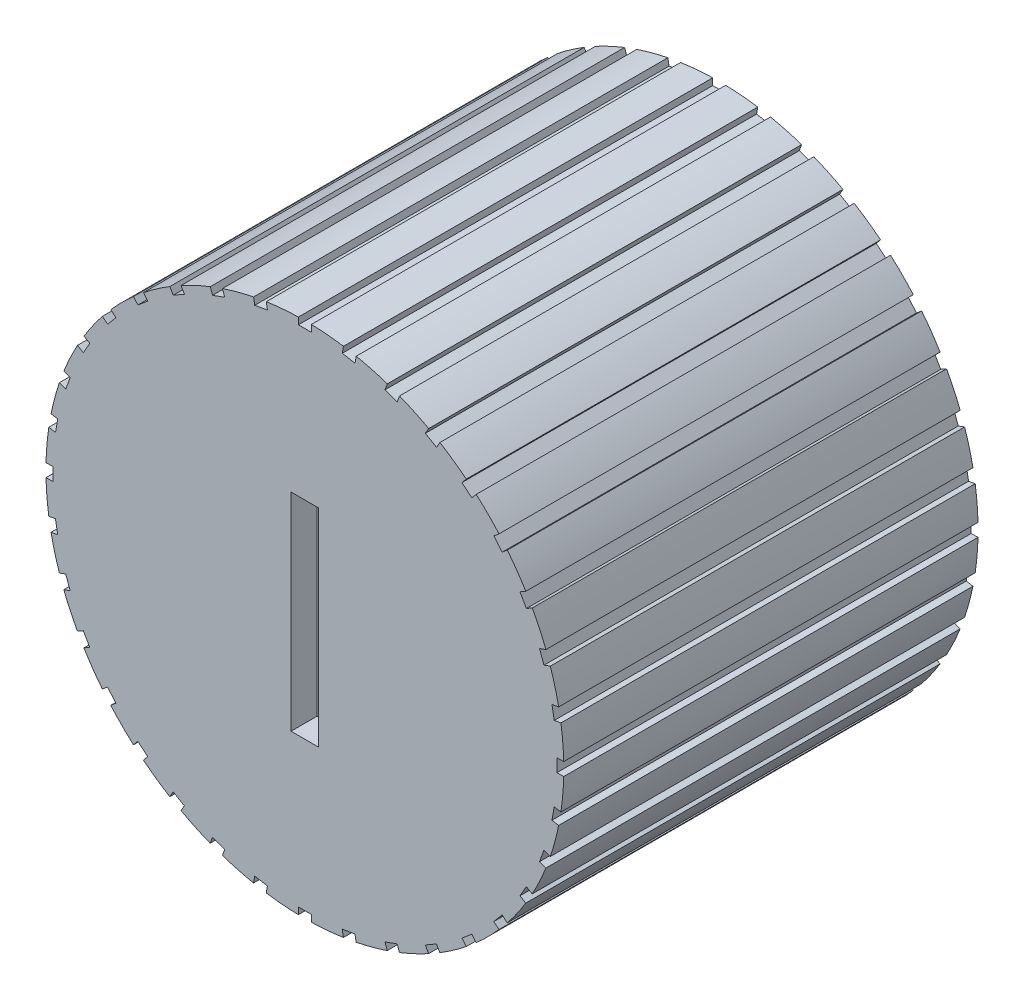
from build123d import *

# Parameters (mm, degrees)
SKETCH1_W                    = 10.000000149
SKETCH1_H                    = 16
CUT_EXTRUDE1_START           = -16
CUT_EXTRUDE1_DEPTH           = 16
CUT_EXTRUDE2_START           = -16
CUT_EXTRUDE2_DEPTH           = 16
CUT_EXTRUDE3_START           = -16
CUT_EXTRUDE3_DEPTH           = 16
CUT_EXTRUDE4_START           = -16
CUT_EXTRUDE4_DEPTH           = 16
CUT_EXTRUDE5_START           = -16
CUT_EXTRUDE5_DEPTH           = 16
CUT_EXTRUDE6_START           = -16
CUT_EXTRUDE6_DEPTH           = 16
CUT_EXTRUDE7_START           = -16
CUT_EXTRUDE7_DEPTH           = 16
CUT_EXTRUDE8_START           = -16
CUT_EXTRUDE8_DEPTH           = 16
CUT_EXTRUDE9_START           = -16
CUT_EXTRUDE9_DEPTH           = 16
CUT_EXTRUDE10_START          = -16
CUT_EXTRUDE10_DEPTH          = 16
CUT_EXTRUDE11_START          = -16
CUT_EXTRUDE11_DEPTH          = 16
CUT_EXTRUDE12_START          = -16
CUT_EXTRUDE12_DEPTH          = 16
CUT_EXTRUDE13_START          = -16
CUT_EXTRUDE13_DEPTH          = 16
CUT_EXTRUDE14_START          = -16
CUT_EXTRUDE14_DEPTH          = 16
CUT_EXTRUDE15_START          = -16
CUT_EXTRUDE15_DEPTH          = 16
CUT_EXTRUDE16_START          = -16
CUT_EXTRUDE16_DEPTH          = 16
CUT_EXTRUDE17_START          = -16
CUT_EXTRUDE17_DEPTH          = 16
CUT_EXTRUDE18_START          = -16
CUT_EXTRUDE18_DEPTH          = 16
CUT_EXTRUDE19_START          = -16
CUT_EXTRUDE19_DEPTH          = 16
CUT_EXTRUDE20_START          = -16
CUT_EXTRUDE20_DEPTH          = 16
CUT_EXTRUDE21_START          = -16
CUT_EXTRUDE21_DEPTH          = 16
CUT_EXTRUDE22_START          = -16
CUT_EXTRUDE22_DEPTH          = 16
CUT_EXTRUDE23_START          = -16
CUT_EXTRUDE23_DEPTH          = 16
CUT_EXTRUDE24_START          = -16
CUT_EXTRUDE24_DEPTH          = 16
CUT_EXTRUDE25_START          = -16
CUT_EXTRUDE25_DEPTH          = 16
CUT_EXTRUDE26_START          = -16
CUT_EXTRUDE26_DEPTH          = 16
CUT_EXTRUDE27_START          = -16
CUT_EXTRUDE27_DEPTH          = 16
CUT_EXTRUDE28_START          = -16
CUT_EXTRUDE28_DEPTH          = 16
CUT_EXTRUDE29_START          = -16
CUT_EXTRUDE29_DEPTH          = 16
CUT_EXTRUDE30_START          = -16
CUT_EXTRUDE30_DEPTH          = 16
CUT_EXTRUDE31_START          = -16
CUT_EXTRUDE31_DEPTH          = 16
CUT_EXTRUDE32_START          = -16
CUT_EXTRUDE32_DEPTH          = 16
CUT_EXTRUDE33_START          = -16
CUT_EXTRUDE33_DEPTH          = 16
CUT_EXTRUDE34_START          = -16
CUT_EXTRUDE34_DEPTH          = 16
CUT_EXTRUDE35_START          = -16
CUT_EXTRUDE35_DEPTH          = 16
CUT_EXTRUDE36_START          = -16
CUT_EXTRUDE36_DEPTH          = 16
CUT_EXTRUDE37_DEPTH          = 1
F_6_0_6_DIAMETER_HOLE1_D     = 6
F_6_0_6_DIAMETER_HOLE1_DEPTH = 14


with BuildPart() as part:
    # Sketch1 → Revolve1 (revolve)
    with BuildSketch(Plane(origin=(0, 0, 0), x_dir=(1, 0, 0), z_dir=(0, 1, 0))):
        with Locations((5.000000074, -8)):
            Rectangle(SKETCH1_W, SKETCH1_H)
    revolve(axis=Axis((0, 0, 0), (0, 0, 1)))

    # Sketch2 → Cut-Extrude1 (cut)
    with BuildSketch(Plane.XY.offset(16).offset(CUT_EXTRUDE1_START)):
        with BuildLine():
            Line((-0.248423386, 9.996913964), (-0.248423386, 9.735553523))
            Line((-0.248423386, 9.735553523), (0.251275635, 9.735553523))
            Line((0.251275635, 9.735553523), (0.251275635, 9.996842678))
            ThreePointArc((0.251275635, 9.996842678), (0.00142657, 10.000000047), (-0.248423386, 9.996913964))
        make_face()
    extrude(amount=CUT_EXTRUDE1_DEPTH, mode=Mode.SUBTRACT)

    # Sketch3 → Cut-Extrude2 (cut)
    with BuildSketch(Plane.XY.offset(16).offset(CUT_EXTRUDE2_START)):
        with BuildLine():
            Line((1.491296615, 9.888176646), (1.445911851, 9.630786858))
            Line((1.445911851, 9.630786858), (1.938019322, 9.544015033))
            Line((1.938019322, 9.544015033), (1.983391707, 9.801334619))
            ThreePointArc((1.983391707, 9.801334619), (1.737886682, 9.847829855), (1.491296615, 9.888176646))
        make_face()
    extrude(amount=CUT_EXTRUDE2_DEPTH, mode=Mode.SUBTRACT)

    # Sketch4 → Cut-Extrude3 (cut)
    with BuildSketch(Plane.XY.offset(16).offset(CUT_EXTRUDE3_START)):
        with BuildLine():
            Line((3.185704324, 9.478992085), (3.096313789, 9.233393607))
            Line((3.096313789, 9.233393607), (3.565877272, 9.062486476))
            Line((3.565877272, 9.062486476), (3.655243426, 9.308017967))
            ThreePointArc((3.655243426, 9.308017967), (3.421541987, 9.396438337), (3.185704324, 9.478992085))
        make_face()
    extrude(amount=CUT_EXTRUDE3_DEPTH, mode=Mode.SUBTRACT)

    # Sketch5 → Cut-Extrude4 (cut)
    with BuildSketch(Plane.XY.offset(16).offset(CUT_EXTRUDE4_START)):
        with BuildLine():
            Line((4.783316019, 8.781793145), (4.652635798, 8.555448364))
            Line((4.652635798, 8.555448364), (5.085387845, 8.305598853))
            Line((5.085387845, 8.305598853), (5.216032423, 8.531881899))
            ThreePointArc((5.216032423, 8.531881899), (5.001235469, 8.659540794), (4.783316019, 8.781793145))
        make_face()
    extrude(amount=CUT_EXTRUDE4_DEPTH, mode=Mode.SUBTRACT)

    # Sketch6 → Cut-Extrude5 (cut)
    with BuildSketch(Plane.XY.offset(16).offset(CUT_EXTRUDE5_START)):
        with BuildLine():
            Line((6.235589077, 7.817763865), (6.067589824, 7.617550152))
            Line((6.067589824, 7.617550152), (6.450381482, 7.296349812))
            Line((6.450381482, 7.296349812), (6.618334914, 7.496508918))
            ThreePointArc((6.618334914, 7.496508918), (6.428968943, 7.659527486), (6.235589077, 7.817763865))
        make_face()
    extrude(amount=CUT_EXTRUDE5_DEPTH, mode=Mode.SUBTRACT)

    # Sketch7 → Cut-Extrude6 (cut)
    with BuildSketch(Plane.XY.offset(16).offset(CUT_EXTRUDE6_START)):
        with BuildLine():
            Line((7.498396916, 6.616195786), (7.298183202, 6.448196533))
            Line((7.298183202, 6.448196533), (7.619383542, 6.065404874))
            Line((7.619383542, 6.065404874), (7.819542647, 6.233358306))
            ThreePointArc((7.819542647, 6.233358306), (7.661361449, 6.426783311), (7.498396916, 6.616195786))
        make_face()
    extrude(amount=CUT_EXTRUDE6_DEPTH, mode=Mode.SUBTRACT)

    # Sketch8 → Cut-Extrude7 (cut)
    with BuildSketch(Plane.XY.offset(16).offset(CUT_EXTRUDE7_START)):
        with BuildLine():
            Line((8.533369759, 5.213597945), (8.307024978, 5.082917725))
            Line((8.307024978, 5.082917725), (8.556874488, 4.650165678))
            Line((8.556874488, 4.650165678), (8.783157535, 4.780810256))
            ThreePointArc((8.783157535, 4.780810256), (8.660967364, 4.998764578), (8.533369759, 5.213597945))
        make_face()
    extrude(amount=CUT_EXTRUDE7_DEPTH, mode=Mode.SUBTRACT)

    # Sketch9 → Cut-Extrude8 (cut)
    with BuildSketch(Plane.XY.offset(16).offset(CUT_EXTRUDE8_START)):
        with BuildLine():
            Line((9.30906048, 3.65258757), (9.063462003, 3.563197034))
            Line((9.063462003, 3.563197034), (9.234369134, 3.093633551))
            Line((9.234369134, 3.093633551), (9.479900625, 3.182999705))
            ThreePointArc((9.479900625, 3.182999705), (9.397414168, 3.418860912), (9.30906048, 3.65258757))
        make_face()
    extrude(amount=CUT_EXTRUDE8_DEPTH, mode=Mode.SUBTRACT)

    # Sketch10 → Cut-Extrude9 (cut)
    with BuildSketch(Plane.XY.offset(16).offset(CUT_EXTRUDE9_START)):
        with BuildLine():
            Line((9.80190011, 1.980595169), (9.544510321, 1.935210405))
            Line((9.544510321, 1.935210405), (9.631282146, 1.443102934))
            Line((9.631282146, 1.443102934), (9.888601731, 1.48847532))
            ThreePointArc((9.888601731, 1.48847532), (9.848325298, 1.735076888), (9.80190011, 1.980595169))
        make_face()
    extrude(amount=CUT_EXTRUDE9_DEPTH, mode=Mode.SUBTRACT)

    # Sketch11 → Cut-Extrude10 (cut)
    with BuildSketch(Plane.XY.offset(16).offset(CUT_EXTRUDE10_START)):
        with BuildLine():
            Line((9.996913964, 0.248423386), (9.735553523, 0.248423386))
            Line((9.735553523, 0.248423386), (9.735553523, -0.251275635))
            Line((9.735553523, -0.251275635), (9.996842678, -0.251275635))
            ThreePointArc((9.996842678, -0.251275635), (10.000000047, -0.00142657), (9.996913964, 0.248423386))
        make_face()
    extrude(amount=CUT_EXTRUDE10_DEPTH, mode=Mode.SUBTRACT)

    # Sketch12 → Cut-Extrude11 (cut)
    with BuildSketch(Plane.XY.offset(16).offset(CUT_EXTRUDE11_START)):
        with BuildLine():
            Line((9.888176646, -1.491296615), (9.630786858, -1.445911851))
            Line((9.630786858, -1.445911851), (9.544015033, -1.938019322))
            Line((9.544015033, -1.938019322), (9.801334619, -1.983391707))
            ThreePointArc((9.801334619, -1.983391707), (9.847829855, -1.737886682), (9.888176646, -1.491296615))
        make_face()
    extrude(amount=CUT_EXTRUDE11_DEPTH, mode=Mode.SUBTRACT)

    # Sketch13 → Cut-Extrude12 (cut)
    with BuildSketch(Plane.XY.offset(16).offset(CUT_EXTRUDE12_START)):
        with BuildLine():
            Line((9.478992085, -3.185704324), (9.233393607, -3.096313789))
            Line((9.233393607, -3.096313789), (9.062486476, -3.565877272))
            Line((9.062486476, -3.565877272), (9.308017967, -3.655243426))
            ThreePointArc((9.308017967, -3.655243426), (9.396438337, -3.421541987), (9.478992085, -3.185704324))
        make_face()
    extrude(amount=CUT_EXTRUDE12_DEPTH, mode=Mode.SUBTRACT)

    # Sketch14 → Cut-Extrude13 (cut)
    with BuildSketch(Plane.XY.offset(16).offset(CUT_EXTRUDE13_START)):
        with BuildLine():
            Line((8.781793145, -4.783316019), (8.555448364, -4.652635798))
            Line((8.555448364, -4.652635798), (8.305598853, -5.085387845))
            Line((8.305598853, -5.085387845), (8.531881899, -5.216032423))
            ThreePointArc((8.531881899, -5.216032423), (8.659540794, -5.001235469), (8.781793145, -4.783316019))
        make_face()
    extrude(amount=CUT_EXTRUDE13_DEPTH, mode=Mode.SUBTRACT)

    # Sketch15 → Cut-Extrude14 (cut)
    with BuildSketch(Plane.XY.offset(16).offset(CUT_EXTRUDE14_START)):
        with BuildLine():
            Line((7.817763865, -6.235589077), (7.617550152, -6.067589824))
            Line((7.617550152, -6.067589824), (7.296349812, -6.450381482))
            Line((7.296349812, -6.450381482), (7.496508918, -6.618334914))
            ThreePointArc((7.496508918, -6.618334914), (7.659527486, -6.428968943), (7.817763865, -6.235589077))
        make_face()
    extrude(amount=CUT_EXTRUDE14_DEPTH, mode=Mode.SUBTRACT)

    # Sketch16 → Cut-Extrude15 (cut)
    with BuildSketch(Plane.XY.offset(16).offset(CUT_EXTRUDE15_START)):
        with BuildLine():
            Line((6.616195786, -7.498396916), (6.448196533, -7.298183202))
            Line((6.448196533, -7.298183202), (6.065404874, -7.619383542))
            Line((6.065404874, -7.619383542), (6.233358306, -7.819542647))
            ThreePointArc((6.233358306, -7.819542647), (6.426783311, -7.661361449), (6.616195786, -7.498396916))
        make_face()
    extrude(amount=CUT_EXTRUDE15_DEPTH, mode=Mode.SUBTRACT)

    # Sketch17 → Cut-Extrude16 (cut)
    with BuildSketch(Plane.XY.offset(16).offset(CUT_EXTRUDE16_START)):
        with BuildLine():
            Line((5.213597945, -8.533369759), (5.082917725, -8.307024978))
            Line((5.082917725, -8.307024978), (4.650165678, -8.556874488))
            Line((4.650165678, -8.556874488), (4.780810256, -8.783157535))
            ThreePointArc((4.780810256, -8.783157535), (4.998764578, -8.660967364), (5.213597945, -8.533369759))
        make_face()
    extrude(amount=CUT_EXTRUDE16_DEPTH, mode=Mode.SUBTRACT)

    # Sketch18 → Cut-Extrude17 (cut)
    with BuildSketch(Plane.XY.offset(16).offset(CUT_EXTRUDE17_START)):
        with BuildLine():
            Line((3.65258757, -9.30906048), (3.563197034, -9.063462003))
            Line((3.563197034, -9.063462003), (3.093633551, -9.234369134))
            Line((3.093633551, -9.234369134), (3.182999705, -9.479900625))
            ThreePointArc((3.182999705, -9.479900625), (3.418860912, -9.397414168), (3.65258757, -9.30906048))
        make_face()
    extrude(amount=CUT_EXTRUDE17_DEPTH, mode=Mode.SUBTRACT)

    # Sketch19 → Cut-Extrude18 (cut)
    with BuildSketch(Plane.XY.offset(16).offset(CUT_EXTRUDE18_START)):
        with BuildLine():
            Line((1.980595169, -9.80190011), (1.935210405, -9.544510321))
            Line((1.935210405, -9.544510321), (1.443102934, -9.631282146))
            Line((1.443102934, -9.631282146), (1.48847532, -9.888601731))
            ThreePointArc((1.48847532, -9.888601731), (1.735076888, -9.848325298), (1.980595169, -9.80190011))
        make_face()
    extrude(amount=CUT_EXTRUDE18_DEPTH, mode=Mode.SUBTRACT)

    # Sketch20 → Cut-Extrude19 (cut)
    with BuildSketch(Plane.XY.offset(16).offset(CUT_EXTRUDE19_START)):
        with BuildLine():
            Line((0.248423386, -9.996913964), (0.248423386, -9.735553523))
            Line((0.248423386, -9.735553523), (-0.251275635, -9.735553523))
            Line((-0.251275635, -9.735553523), (-0.251275635, -9.996842678))
            ThreePointArc((-0.251275635, -9.996842678), (-0.00142657, -10.000000047), (0.248423386, -9.996913964))
        make_face()
    extrude(amount=CUT_EXTRUDE19_DEPTH, mode=Mode.SUBTRACT)

    # Sketch21 → Cut-Extrude20 (cut)
    with BuildSketch(Plane.XY.offset(16).offset(CUT_EXTRUDE20_START)):
        with BuildLine():
            Line((-1.491296615, -9.888176646), (-1.445911851, -9.630786858))
            Line((-1.445911851, -9.630786858), (-1.938019322, -9.544015033))
            Line((-1.938019322, -9.544015033), (-1.983391707, -9.801334619))
            ThreePointArc((-1.983391707, -9.801334619), (-1.737886682, -9.847829855), (-1.491296615, -9.888176646))
        make_face()
    extrude(amount=CUT_EXTRUDE20_DEPTH, mode=Mode.SUBTRACT)

    # Sketch22 → Cut-Extrude21 (cut)
    with BuildSketch(Plane.XY.offset(16).offset(CUT_EXTRUDE21_START)):
        with BuildLine():
            Line((-3.185704324, -9.478992085), (-3.096313789, -9.233393607))
            Line((-3.096313789, -9.233393607), (-3.565877272, -9.062486476))
            Line((-3.565877272, -9.062486476), (-3.655243426, -9.308017967))
            ThreePointArc((-3.655243426, -9.308017967), (-3.421541987, -9.396438337), (-3.185704324, -9.478992085))
        make_face()
    extrude(amount=CUT_EXTRUDE21_DEPTH, mode=Mode.SUBTRACT)

    # Sketch23 → Cut-Extrude22 (cut)
    with BuildSketch(Plane.XY.offset(16).offset(CUT_EXTRUDE22_START)):
        with BuildLine():
            Line((-4.783316019, -8.781793145), (-4.652635798, -8.555448364))
            Line((-4.652635798, -8.555448364), (-5.085387845, -8.305598853))
            Line((-5.085387845, -8.305598853), (-5.216032423, -8.531881899))
            ThreePointArc((-5.216032423, -8.531881899), (-5.001235469, -8.659540794), (-4.783316019, -8.781793145))
        make_face()
    extrude(amount=CUT_EXTRUDE22_DEPTH, mode=Mode.SUBTRACT)

    # Sketch24 → Cut-Extrude23 (cut)
    with BuildSketch(Plane.XY.offset(16).offset(CUT_EXTRUDE23_START)):
        with BuildLine():
            Line((-6.235589077, -7.817763865), (-6.067589824, -7.617550152))
            Line((-6.067589824, -7.617550152), (-6.450381482, -7.296349812))
            Line((-6.450381482, -7.296349812), (-6.618334914, -7.496508918))
            ThreePointArc((-6.618334914, -7.496508918), (-6.428968943, -7.659527486), (-6.235589077, -7.817763865))
        make_face()
    extrude(amount=CUT_EXTRUDE23_DEPTH, mode=Mode.SUBTRACT)

    # Sketch25 → Cut-Extrude24 (cut)
    with BuildSketch(Plane.XY.offset(16).offset(CUT_EXTRUDE24_START)):
        with BuildLine():
            Line((-7.498396916, -6.616195786), (-7.298183202, -6.448196533))
            Line((-7.298183202, -6.448196533), (-7.619383542, -6.065404874))
            Line((-7.619383542, -6.065404874), (-7.819542647, -6.233358306))
            ThreePointArc((-7.819542647, -6.233358306), (-7.661361449, -6.426783311), (-7.498396916, -6.616195786))
        make_face()
    extrude(amount=CUT_EXTRUDE24_DEPTH, mode=Mode.SUBTRACT)

    # Sketch26 → Cut-Extrude25 (cut)
    with BuildSketch(Plane.XY.offset(16).offset(CUT_EXTRUDE25_START)):
        with BuildLine():
            Line((-8.533369759, -5.213597945), (-8.307024978, -5.082917725))
            Line((-8.307024978, -5.082917725), (-8.556874488, -4.650165678))
            Line((-8.556874488, -4.650165678), (-8.783157535, -4.780810256))
            ThreePointArc((-8.783157535, -4.780810256), (-8.660967364, -4.998764578), (-8.533369759, -5.213597945))
        make_face()
    extrude(amount=CUT_EXTRUDE25_DEPTH, mode=Mode.SUBTRACT)

    # Sketch27 → Cut-Extrude26 (cut)
    with BuildSketch(Plane.XY.offset(16).offset(CUT_EXTRUDE26_START)):
        with BuildLine():
            Line((-9.30906048, -3.65258757), (-9.063462003, -3.563197034))
            Line((-9.063462003, -3.563197034), (-9.234369134, -3.093633551))
            Line((-9.234369134, -3.093633551), (-9.479900625, -3.182999705))
            ThreePointArc((-9.479900625, -3.182999705), (-9.397414168, -3.418860912), (-9.30906048, -3.65258757))
        make_face()
    extrude(amount=CUT_EXTRUDE26_DEPTH, mode=Mode.SUBTRACT)

    # Sketch28 → Cut-Extrude27 (cut)
    with BuildSketch(Plane.XY.offset(16).offset(CUT_EXTRUDE27_START)):
        with BuildLine():
            Line((-9.80190011, -1.980595169), (-9.544510321, -1.935210405))
            Line((-9.544510321, -1.935210405), (-9.631282146, -1.443102934))
            Line((-9.631282146, -1.443102934), (-9.888601731, -1.48847532))
            ThreePointArc((-9.888601731, -1.48847532), (-9.848325298, -1.735076888), (-9.80190011, -1.980595169))
        make_face()
    extrude(amount=CUT_EXTRUDE27_DEPTH, mode=Mode.SUBTRACT)

    # Sketch29 → Cut-Extrude28 (cut)
    with BuildSketch(Plane.XY.offset(16).offset(CUT_EXTRUDE28_START)):
        with BuildLine():
            Line((-9.996913964, -0.248423386), (-9.735553523, -0.248423386))
            Line((-9.735553523, -0.248423386), (-9.735553523, 0.251275635))
            Line((-9.735553523, 0.251275635), (-9.996842678, 0.251275635))
            ThreePointArc((-9.996842678, 0.251275635), (-10.000000047, 0.00142657), (-9.996913964, -0.248423386))
        make_face()
    extrude(amount=CUT_EXTRUDE28_DEPTH, mode=Mode.SUBTRACT)

    # Sketch30 → Cut-Extrude29 (cut)
    with BuildSketch(Plane.XY.offset(16).offset(CUT_EXTRUDE29_START)):
        with BuildLine():
            Line((-9.888176646, 1.491296615), (-9.630786858, 1.445911851))
            Line((-9.630786858, 1.445911851), (-9.544015033, 1.938019322))
            Line((-9.544015033, 1.938019322), (-9.801334619, 1.983391707))
            ThreePointArc((-9.801334619, 1.983391707), (-9.847829855, 1.737886682), (-9.888176646, 1.491296615))
        make_face()
    extrude(amount=CUT_EXTRUDE29_DEPTH, mode=Mode.SUBTRACT)

    # Sketch31 → Cut-Extrude30 (cut)
    with BuildSketch(Plane.XY.offset(16).offset(CUT_EXTRUDE30_START)):
        with BuildLine():
            Line((-9.478992085, 3.185704324), (-9.233393607, 3.096313789))
            Line((-9.233393607, 3.096313789), (-9.062486476, 3.565877272))
            Line((-9.062486476, 3.565877272), (-9.308017967, 3.655243426))
            ThreePointArc((-9.308017967, 3.655243426), (-9.396438337, 3.421541987), (-9.478992085, 3.185704324))
        make_face()
    extrude(amount=CUT_EXTRUDE30_DEPTH, mode=Mode.SUBTRACT)

    # Sketch32 → Cut-Extrude31 (cut)
    with BuildSketch(Plane.XY.offset(16).offset(CUT_EXTRUDE31_START)):
        with BuildLine():
            Line((-8.781793145, 4.783316019), (-8.555448364, 4.652635798))
            Line((-8.555448364, 4.652635798), (-8.305598853, 5.085387845))
            Line((-8.305598853, 5.085387845), (-8.531881899, 5.216032423))
            ThreePointArc((-8.531881899, 5.216032423), (-8.659540794, 5.001235469), (-8.781793145, 4.783316019))
        make_face()
    extrude(amount=CUT_EXTRUDE31_DEPTH, mode=Mode.SUBTRACT)

    # Sketch33 → Cut-Extrude32 (cut)
    with BuildSketch(Plane.XY.offset(16).offset(CUT_EXTRUDE32_START)):
        with BuildLine():
            Line((-7.817763865, 6.235589077), (-7.617550152, 6.067589824))
            Line((-7.617550152, 6.067589824), (-7.296349812, 6.450381482))
            Line((-7.296349812, 6.450381482), (-7.496508918, 6.618334914))
            ThreePointArc((-7.496508918, 6.618334914), (-7.659527486, 6.428968943), (-7.817763865, 6.235589077))
        make_face()
    extrude(amount=CUT_EXTRUDE32_DEPTH, mode=Mode.SUBTRACT)

    # Sketch34 → Cut-Extrude33 (cut)
    with BuildSketch(Plane.XY.offset(16).offset(CUT_EXTRUDE33_START)):
        with BuildLine():
            Line((-6.616195786, 7.498396916), (-6.448196533, 7.298183202))
            Line((-6.448196533, 7.298183202), (-6.065404874, 7.619383542))
            Line((-6.065404874, 7.619383542), (-6.233358306, 7.819542647))
            ThreePointArc((-6.233358306, 7.819542647), (-6.426783311, 7.661361449), (-6.616195786, 7.498396916))
        make_face()
    extrude(amount=CUT_EXTRUDE33_DEPTH, mode=Mode.SUBTRACT)

    # Sketch35 → Cut-Extrude34 (cut)
    with BuildSketch(Plane.XY.offset(16).offset(CUT_EXTRUDE34_START)):
        with BuildLine():
            Line((-5.213597945, 8.533369759), (-5.082917725, 8.307024978))
            Line((-5.082917725, 8.307024978), (-4.650165678, 8.556874488))
            Line((-4.650165678, 8.556874488), (-4.780810256, 8.783157535))
            ThreePointArc((-4.780810256, 8.783157535), (-4.998764578, 8.660967364), (-5.213597945, 8.533369759))
        make_face()
    extrude(amount=CUT_EXTRUDE34_DEPTH, mode=Mode.SUBTRACT)

    # Sketch36 → Cut-Extrude35 (cut)
    with BuildSketch(Plane.XY.offset(16).offset(CUT_EXTRUDE35_START)):
        with BuildLine():
            Line((-3.65258757, 9.30906048), (-3.563197034, 9.063462003))
            Line((-3.563197034, 9.063462003), (-3.093633551, 9.234369134))
            Line((-3.093633551, 9.234369134), (-3.182999705, 9.479900625))
            ThreePointArc((-3.182999705, 9.479900625), (-3.418860912, 9.397414168), (-3.65258757, 9.30906048))
        make_face()
    extrude(amount=CUT_EXTRUDE35_DEPTH, mode=Mode.SUBTRACT)

    # Sketch37 → Cut-Extrude36 (cut)
    with BuildSketch(Plane.XY.offset(16).offset(CUT_EXTRUDE36_START)):
        with BuildLine():
            Line((-1.980595169, 9.80190011), (-1.935210405, 9.544510321))
            Line((-1.935210405, 9.544510321), (-1.443102934, 9.631282146))
            Line((-1.443102934, 9.631282146), (-1.48847532, 9.888601731))
            ThreePointArc((-1.48847532, 9.888601731), (-1.735076888, 9.848325298), (-1.980595169, 9.80190011))
        make_face()
    extrude(amount=CUT_EXTRUDE36_DEPTH, mode=Mode.SUBTRACT)

    # Sketch38 → Cut-Extrude37 (cut)
    with BuildSketch(Plane.XY.offset(16)):
        Polygon((-0.532920753, -3.999523785), (0.525741951, -4.000473773), (0.532920726, 3.999523125), (-0.525741978, 4.000473113), align=None)
    extrude(amount=-CUT_EXTRUDE37_DEPTH, mode=Mode.SUBTRACT)

    # Ø6.0 (6) Diameter Hole1
    with Locations(Plane(origin=(0, 0, 0), x_dir=(-1, 0, 0), z_dir=(0, 0, -1))):
        with Locations((0, 0)):
            Hole(F_6_0_6_DIAMETER_HOLE1_D / 2, depth=F_6_0_6_DIAMETER_HOLE1_DEPTH)


solid = part.part
